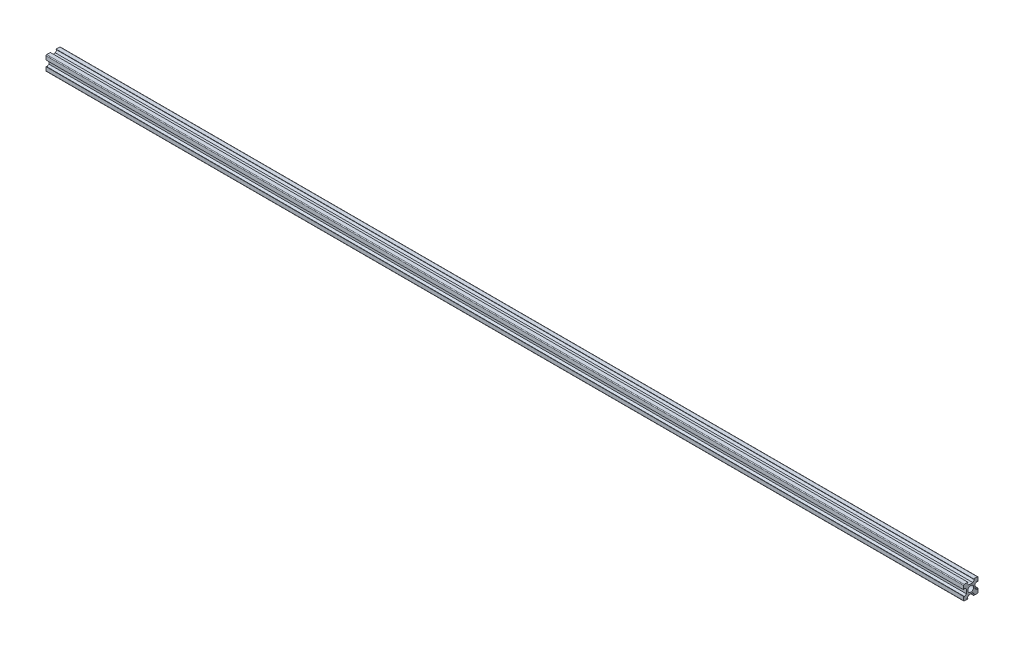
from build123d import *

# Parameters (mm, degrees)
SKETCH_1_W                       = 1270
SKETCH_1_H                       = 10
EXTRUDE_1_DEPTH                  = 10
SKETCH_2_R                       = 4
CUT_EXTRUDE_1_DEPTH              = 1270
CUT_EXTRUDE_2_DEPTH              = 1270
FILLET_1_R                       = 1
PATTERN_CIRCULAR_2_COUNT         = 4
FILLET_1_OF_PATTERN_CIRCULAR_2_R = 1


with BuildPart() as part:
    # 草图1 → 凸台-拉伸1 (new body)
    with BuildSketch(Plane.XY):
        with Locations((568.481285353, -6.397869645)):
            Rectangle(SKETCH_1_W, SKETCH_1_H)
    extrude_1 = extrude(amount=EXTRUDE_1_DEPTH)

    # 草图2 → 切除-拉伸1 (cut)
    with BuildSketch(Plane(origin=(1203.481285353, 0, 0), x_dir=(0, 0, -1), z_dir=(1, 0, 0))):
        with Locations((0, -11.397869645)):
            Circle(SKETCH_2_R)
    cut_extrude_1 = extrude(amount=-CUT_EXTRUDE_1_DEPTH, mode=Mode.SUBTRACT)

    # 草图3 → 切除-拉伸2 (cut)
    with BuildSketch(Plane(origin=(1203.481285353, 0, 0), x_dir=(0, 0, -1), z_dir=(1, 0, 0))):
        Polygon((-4, -1.397869645), (0, -1.397869645), (0, -5.397869645), (-3, -5.397869645), (-5.5, -1.897869645), (-4, -1.897869645), align=None)
        Polygon((-10, -7.397869645), (-10, -11.397869645), (-6, -11.397869645), (-6, -8.397869645), (-9.5, -5.897869645), (-9.5, -7.397869645), align=None)
    cut_extrude_2 = extrude(amount=-CUT_EXTRUDE_2_DEPTH, mode=Mode.SUBTRACT)

    # 圆角1
    fillet_1_edges = [part.edges().sort_by_distance(p)[0] for p in [
        (568.481285353, -1.397869645, 10),
    ]]
    fillet(fillet_1_edges, radius=FILLET_1_R)

    # 阵列(圆周)2: 凸台-拉伸1, 切除-拉伸1, 切除-拉伸2 ×4 about axis
    pattern_circular_2_axis = Axis((0, -11.397869645, 0), (1, 0, 0))
    add([extrude_1.rotate(pattern_circular_2_axis, i * 360 / PATTERN_CIRCULAR_2_COUNT) for i in range(1, PATTERN_CIRCULAR_2_COUNT)])
    add([cut_extrude_1.rotate(pattern_circular_2_axis, i * 360 / PATTERN_CIRCULAR_2_COUNT) for i in range(1, PATTERN_CIRCULAR_2_COUNT)], mode=Mode.SUBTRACT)
    add([cut_extrude_2.rotate(pattern_circular_2_axis, i * 360 / PATTERN_CIRCULAR_2_COUNT) for i in range(1, PATTERN_CIRCULAR_2_COUNT)], mode=Mode.SUBTRACT)

    # 圆角1 of 阵列(圆周)2
    fillet_1_of_pattern_circular_2_edges = [part.edges().sort_by_distance(p)[0] for p in [
        (568.481285353, -21.397869645, 10),
        (568.481285353, -21.397869645, -10),
        (568.481285353, -1.397869645, -10),
    ]]
    fillet(fillet_1_of_pattern_circular_2_edges, radius=FILLET_1_OF_PATTERN_CIRCULAR_2_R)


solid = part.part
